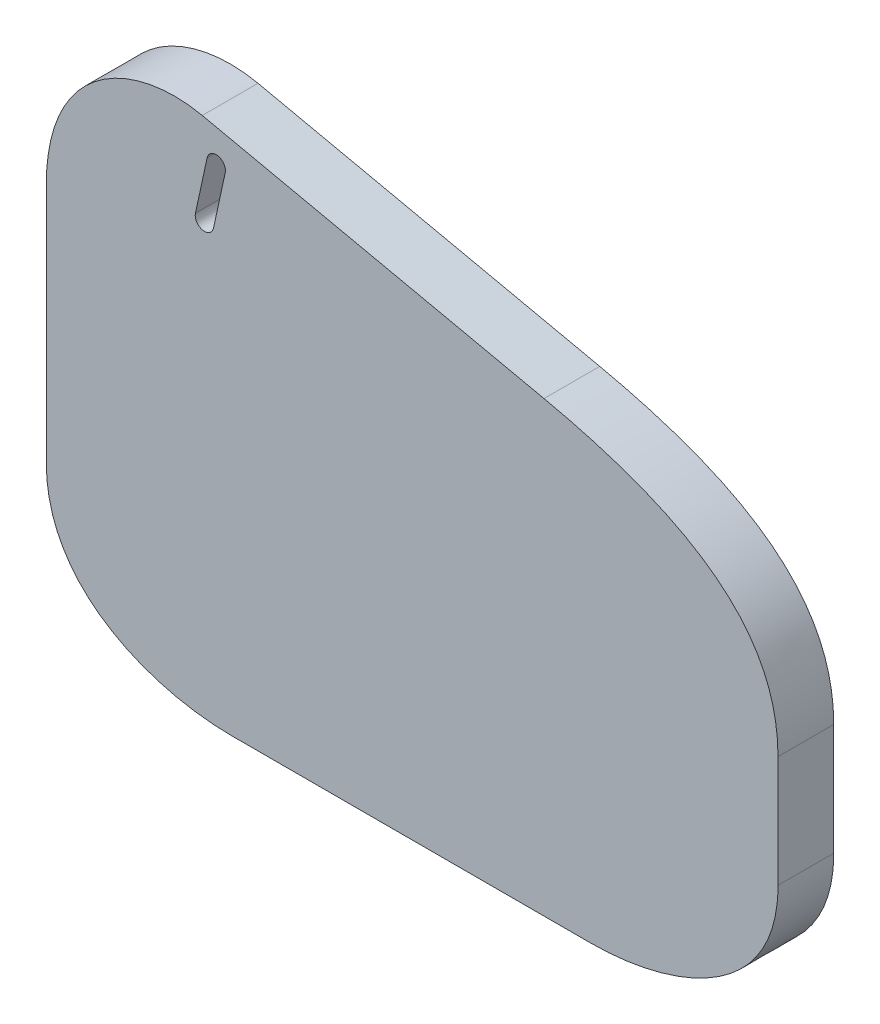
from build123d import *

# Parameters (mm, degrees)
EXTRUDE_1_DEPTH     = 10
CUT_EXTRUDE_1_DEPTH = 149.427210809


with BuildPart() as part:
    # Эскиз1_fr → Бобышка-Вытянуть1 (new body)
    with BuildSketch(Plane.XY):
        with BuildLine():
            Line((0, 0), (0, 20))
            add(Edge.make_bspline(
                [(0, 20), (0, 38.146025899), (-14.209474182, 48.611098897), (-41.986949672, 54.649680525)],
                knots=[0, 0, 0, 0, 1, 1, 1, 1], degree=3))
            Line((-41.986949672, 54.649680525), (-103.301225383, 67.978870897))
            add(Edge.make_bspline(
                [(-103.301225383, 67.978870897), (-115.500001367, 70.63077872), (-131.292525164, 63.393306184), (-131.292525164, 43.097715536)],
                knots=[0, 0, 0, 0, 1, 1, 1, 1], degree=3))
            Line((-131.292525164, 43.097715536), (-131.292525164, 0))
            add(Edge.make_bspline(
                [(-97.969549234, -25.769768053), (-112.011160689, -25.769768053), (-131.292525164, -19.025155818), (-131.292525164, 0)],
                knots=[0, 0, 0, 0, 1, 1, 1, 1], degree=3))
            Line((-97.969549234, -25.769768053), (-33.545129103, -25.769768053))
            add(Edge.make_bspline(
                [(-33.545129103, -25.769768053), (-19.444866568, -25.769768053), (0, -19.063757455), (0, 0)],
                knots=[0, 0, 0, 0, 1, 1, 1, 1], degree=3))
        make_face()
    extrude(amount=EXTRUDE_1_DEPTH)

    # Эскиз2_fr → Вырез-Вытянуть1 (cut, through all)
    with BuildSketch(Plane(origin=(0, 0, 0), x_dir=(-1, 0, 0), z_dir=(0, 0, -1))):
        with BuildLine():
            Line((102.429251955, 61.832882372), (104.527789693, 52.179608775))
            ThreePointArc((104.527789693, 52.179608775), (103.259303337, 50.206407776), (101.286102339, 51.474894133))
            Line((101.286102339, 51.474894133), (99.1875646, 61.128167729))
            ThreePointArc((99.1875646, 61.128167729), (100.456050956, 63.101368728), (102.429251955, 61.832882372))
        make_face()
    extrude(amount=-CUT_EXTRUDE_1_DEPTH, mode=Mode.SUBTRACT)


solid = part.part
